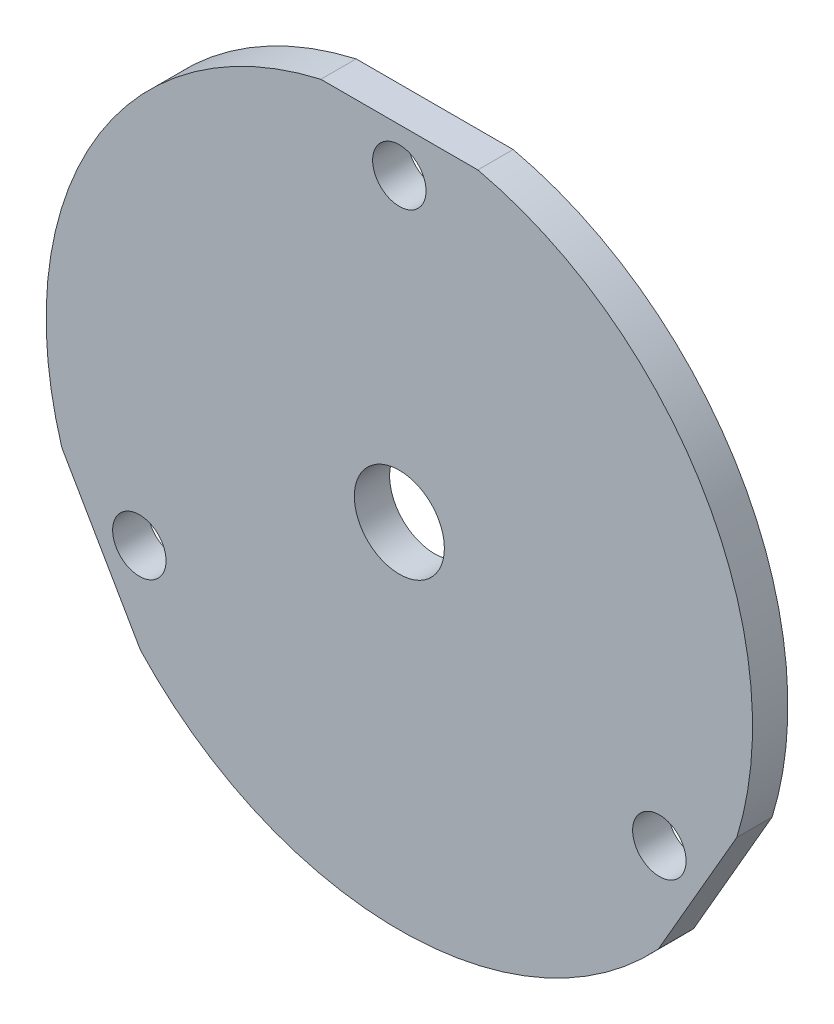
from build123d import *

# Parameters (mm, degrees)
BOSS_EXTRUDE1_START = 0.5
SKETCH1_R           = 40
BOSS_EXTRUDE1_DEPTH = 4
CUT_EXTRUDE1_START  = -6
SKETCH2_R           = 3.025
CUT_EXTRUDE1_DEPTH  = 6
SKETCH3_R           = 5.1
CUT_EXTRUDE2_DEPTH  = 15


with BuildPart() as part:
    # Sketch1 → Boss-Extrude1 (new body)
    with BuildSketch(Plane.XY.offset(BOSS_EXTRUDE1_START)):
        Circle(SKETCH1_R)
    extrude(amount=BOSS_EXTRUDE1_DEPTH)

    # Sketch2 → Cut-Extrude1 (cut)
    with BuildSketch(Plane.XY.offset(4.5).offset(CUT_EXTRUDE1_START)):
        with Locations((0, 34)):
            Circle(SKETCH2_R)
        with Locations((29.444863729, -17)):
            Circle(SKETCH2_R)
        with Locations((-29.444863729, -17)):
            Circle(SKETCH2_R)
        with BuildLine():
            Line((-8.888194417, 39), (8.888194417, 39))
            ThreePointArc((8.888194417, 39), (0, 40), (-8.888194417, 39))
        make_face()
        with BuildLine():
            Line((38.219087956, -11.802597841), (29.330893539, -27.197402159))
            ThreePointArc((29.330893539, -27.197402159), (34.641016151, -20), (38.219087956, -11.802597841))
        make_face()
        with BuildLine():
            Line((-29.330893539, -27.197402159), (-38.219087956, -11.802597841))
            ThreePointArc((-38.219087956, -11.802597841), (-34.641016151, -20), (-29.330893539, -27.197402159))
        make_face()
    extrude(amount=CUT_EXTRUDE1_DEPTH, mode=Mode.SUBTRACT)

    # Sketch3 → Cut-Extrude2 (cut)
    with BuildSketch(Plane.XY.offset(4.5)):
        Circle(SKETCH3_R)
    extrude(amount=-CUT_EXTRUDE2_DEPTH, mode=Mode.SUBTRACT)


solid = part.part
